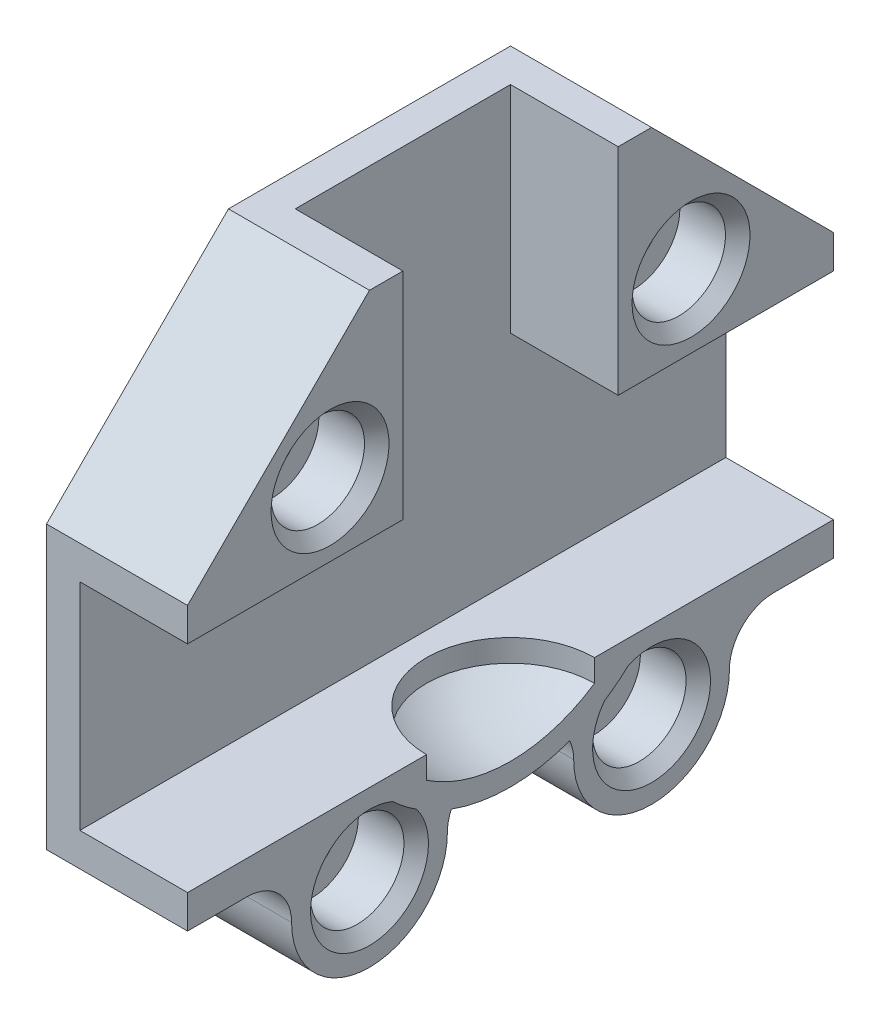
from build123d import *

# Parameters (mm, degrees)
BOSS_EXTRUDE1_DEPTH   = 9.675
SKETCH2_W             = 58.05
SKETCH2_H             = 3
BOSS_EXTRUDE1_2_DEPTH = 9.675
BOSS_EXTRUDE1_3_DEPTH = 9.675
BOSS_EXTRUDE2_DEPTH   = 3
BOSS_EXTRUDE3_DEPTH   = 12.675
SKETCH6_R             = 2.1
CUT_EXTRUDE1_DEPTH    = 43.959945007
SKETCH7_R             = 5
CUT_EXTRUDE2_DEPTH    = 1.5
SKETCH8_R             = 4.2
CUT_EXTRUDE3_DEPTH    = 5.2
CHAMFER1_SIZE         = 1.1
SKETCH9_R             = 7.55
CUT_EXTRUDE4_DEPTH    = 2
REVOLVE1_ANGLE        = 180


with BuildPart() as part:
    # Sketch2 → Boss-Extrude1 (new body)
    with BuildSketch(Plane(origin=(0, 0, 0), x_dir=(0, 0, -1), z_dir=(1, 0, 0))):
        Polygon((-29.025, 9.675), (-29.025, 12.675), (-12.675, 29.025), (-9.675, 29.025), (-9.675, 9.675), align=None)
    extrude(amount=-BOSS_EXTRUDE1_DEPTH)



with BuildPart() as body_2:
    # Sketch2 → Boss-Extrude1 2 (new body)
    with BuildSketch(Plane(origin=(0, 0, 0), x_dir=(0, 0, -1), z_dir=(1, 0, 0))):
        with Locations((0, -11.175)):
            Rectangle(SKETCH2_W, SKETCH2_H)
    extrude(amount=-BOSS_EXTRUDE1_2_DEPTH)


with BuildPart() as body_3:
    # Sketch2 → Boss-Extrude1 3 (new body)
    with BuildSketch(Plane(origin=(0, 0, 0), x_dir=(0, 0, -1), z_dir=(1, 0, 0))):
        Polygon((9.675, 29.025), (12.675, 29.025), (29.025, 12.675), (29.025, 9.675), (9.675, 9.675), align=None)
    extrude(amount=-BOSS_EXTRUDE1_3_DEPTH)


with BuildPart() as part_1:
    add(part.part)

    add(body_2.part)  # Boss-Extrude2 merges body 2

    add(body_3.part)  # Boss-Extrude2 merges body 3
    # Sketch3 → Boss-Extrude2 (add)
    with BuildSketch(Plane.ZY.offset(9.675)):
        Polygon((-29.025, 12.675), (-12.675, 29.025), (12.675, 29.025), (29.025, 12.675), (29.025, -12.675), (-29.025, -12.675), align=None)
    extrude(amount=BOSS_EXTRUDE2_DEPTH)

    # Sketch5 → Boss-Extrude3 (add)
    with BuildSketch(Plane(origin=(0, 0, 0), x_dir=(0, 0, -1), z_dir=(1, 0, 0))):
        with BuildLine():
            Line((-29.025, -12.675), (-23.675, -12.675))
            ThreePointArc((-23.675, -12.675), (-20.846572875, -13.846572875), (-19.675, -16.675))
            ThreePointArc((-19.675, -16.675), (-12.675, -23.675), (-5.675, -16.675))
            ThreePointArc((-5.675, -16.675), (-4.503427125, -13.846572875), (-1.675, -12.675))
            Line((-1.675, -12.675), (1.675, -12.675))
            ThreePointArc((1.675, -12.675), (4.503427125, -13.846572875), (5.675, -16.675))
            ThreePointArc((5.675, -16.675), (12.675, -23.675), (19.675, -16.675))
            ThreePointArc((19.675, -16.675), (20.846572875, -13.846572875), (23.675, -12.675))
            Line((23.675, -12.675), (29.025, -12.675))
            Line((29.025, -12.675), (29.025, -9.675))
            Line((29.025, -9.675), (-29.025, -9.675))
            Line((-29.025, -9.675), (-29.025, -12.675))
        make_face()
    extrude(amount=-BOSS_EXTRUDE3_DEPTH)

    # Sketch6 → Cut-Extrude1 (cut, through all)
    with BuildSketch(Plane(origin=(0, 0, 0), x_dir=(0, 0, -1), z_dir=(1, 0, 0))):
        with Locations((-12.675, -16.675)):
            Circle(SKETCH6_R)
        with Locations((12.675, -16.675)):
            Circle(SKETCH6_R)
        with Locations((-16.22116344, 16.22116344)):
            Circle(SKETCH6_R)
        with Locations(Location((16.22116344, 16.22116344, 0), (0, 0, 180))):
            Circle(SKETCH6_R)
    extrude(amount=-CUT_EXTRUDE1_DEPTH, mode=Mode.SUBTRACT)

    # Sketch7 → Cut-Extrude2 (cut)
    with BuildSketch(Plane.ZY.offset(12.675)):
        with Locations((-16.22116344, 16.22116344)):
            Circle(SKETCH7_R)
        with Locations((16.22116344, 16.22116344)):
            Circle(SKETCH7_R)
        with Locations((-12.675, -16.675)):
            Circle(SKETCH7_R)
        with Locations((12.675, -16.675)):
            Circle(SKETCH7_R)
    extrude(amount=-CUT_EXTRUDE2_DEPTH, mode=Mode.SUBTRACT)

    # Sketch8 → Cut-Extrude3 (cut)
    with BuildSketch(Plane(origin=(0, 0, 0), x_dir=(0, 0, -1), z_dir=(1, 0, 0))):
        with Locations((-16.22116344, 16.22116344)):
            Circle(SKETCH8_R)
        with Locations((16.22116344, 16.22116344)):
            Circle(SKETCH8_R)
        with Locations((12.675, -16.675)):
            Circle(SKETCH8_R)
        with Locations((-12.675, -16.675)):
            Circle(SKETCH8_R)
    extrude(amount=-CUT_EXTRUDE3_DEPTH, mode=Mode.SUBTRACT)

    # Chamfer1
    chamfer1_edges = [part_1.edges().sort_by_distance(p)[0] for p in [
        (0, -16.675, 16.875),
        (0, -16.675, -8.475),
        (0, 16.22116344, -12.02116344),
        (0, 16.22116344, 20.42116344),
    ]]
    chamfer(chamfer1_edges, length=CHAMFER1_SIZE)

    # Sketch9 → Cut-Extrude4 (cut)
    with BuildSketch(Plane(origin=(0, -9.675, 0), x_dir=(1, 0, 0), z_dir=(0, 1, 0))):
        Circle(SKETCH9_R)
    extrude(amount=-CUT_EXTRUDE4_DEPTH, mode=Mode.SUBTRACT)

    # Sketch10 → Revolve1 (revolve)
    with BuildSketch(Plane(origin=(0, 0, 0), x_dir=(0, 0, -1), z_dir=(1, 0, 0))):
        with BuildLine():
            Line((0, -15.975), (0, -11.675))
            Line((0, -11.675), (-10.731723594, -11.675))
            ThreePointArc((-10.731723594, -11.675), (-5.780568556, -14.860004257), (0, -15.975))
        make_face()
    revolve(axis=Axis((0, -15.975, 0), (0, -1, 0)), revolution_arc=REVOLVE1_ANGLE)

    # Sketch11 → Cut-Revolve1 (revolve, cut)
    with BuildSketch(Plane(origin=(0, 0, 0), x_dir=(0, 0, -1), z_dir=(1, 0, 0))):
        with BuildLine():
            Line((0, -13.975), (0, -11.675))
            Line((0, -11.675), (-7.55, -11.675))
            ThreePointArc((-7.55, -11.675), (-3.946279894, -13.387244869), (0, -13.975))
        make_face()
    revolve(axis=Axis((0, -13.975, 0), (0, 1, 0)), mode=Mode.SUBTRACT)


solid = part_1.part
